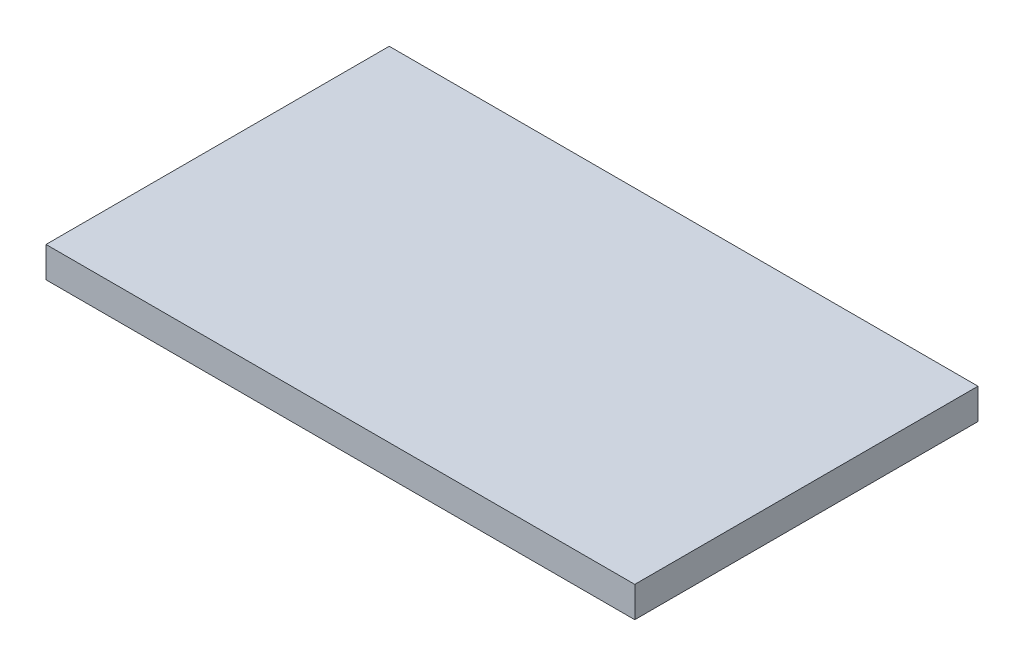
from build123d import *

# Parameters (mm, degrees)
SKETCH1_W           = 38.44
SKETCH1_H           = 22.41
BOSS_EXTRUDE1_DEPTH = 2


with BuildPart() as part:
    # Sketch1 → Boss-Extrude1 (new body)
    with BuildSketch(Plane(origin=(0, 0, 0), x_dir=(1, 0, 0), z_dir=(0, 1, 0))):
        with Locations((19.22, -11.205)):
            Rectangle(SKETCH1_W, SKETCH1_H)
    extrude(amount=BOSS_EXTRUDE1_DEPTH)


solid = part.part
